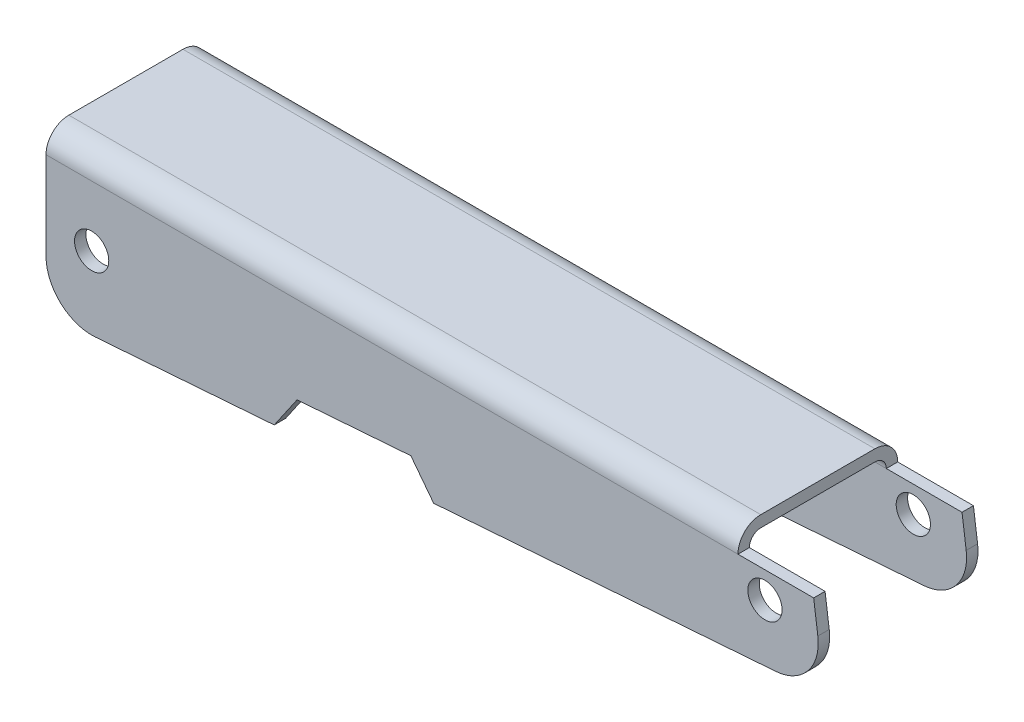
from build123d import *

# Parameters (mm, degrees)
SKETCH1_R               = 1.5
BOSS_EXTRUDE1_DEPTH     = 7
FILLET1_R               = 2
FILLET2_R               = 4
SHELL1_T                = -1
CUT_EXTRUDE1_DEPTH      = 65.079559318
CUT_EXTRUDE1_DEPTH_BACK = 65.079559318
SKETCH3_W               = 7
SKETCH3_H               = 14
CUT_EXTRUDE2_DEPTH      = 2


with BuildPart() as part:
    # Sketch1 → Boss-Extrude1 (new, symmetric)
    with BuildSketch(Plane.XY):
        Polygon((4, 4.3), (-63, 4.3), (-63, -9.7), (5.2, -4.619641248), align=None)
        Circle(SKETCH1_R, mode=Mode.SUBTRACT)
        with Locations((-59, -3)):
            Circle(SKETCH1_R, mode=Mode.SUBTRACT)
    extrude(amount=BOSS_EXTRUDE1_DEPTH, both=True)

    # Fillet1
    fillet1_edges = [part.edges().sort_by_distance(p)[0] for p in [
        (-29.5, 4.3, 7),
        (-29.5, 4.3, -7),
    ]]
    fillet(fillet1_edges, radius=FILLET1_R)

    # Fillet2
    fillet2_edges = [part.edges().sort_by_distance(p)[0] for p in [
        (-63, -9.7, 0),
        (5.2, -4.619641248, 0),
    ]]
    fillet(fillet2_edges, radius=FILLET2_R)

    # Shell1
    shell1_openings = [part.faces().sort_by_distance(p)[0] for p in [
        (-60.5, -3, 0),
        (-1.5, 0, 0),
        (-61.721343434, -8.3225509, 0),
        (3.776615154, -3.465411477, 0),
        (-63, -0.601849653, 0),
        (4.323873752, 1.892635268, 0),
        (-28.867987445, -7.157435943, 0),
    ]]
    offset(amount=SHELL1_T, openings=shell1_openings, kind=Kind.INTERSECTION)

    # Sketch2 → Cut-Extrude1 (cut, two sides: drawn at the far end of the back side and taken through both)
    with BuildSketch(Plane.XY.offset(-CUT_EXTRUDE1_DEPTH_BACK)):
        Polygon((-43, -8.210158724), (-41, -5.303555184), (-31.027630399, -4.560692791), (-29.027630399, -7.169328076), align=None)
    extrude(amount=CUT_EXTRUDE1_DEPTH + CUT_EXTRUDE1_DEPTH_BACK, mode=Mode.SUBTRACT)

    # Sketch3 → Cut-Extrude2 (cut)
    with BuildSketch(Plane(origin=(0, 4.3, 0), x_dir=(1, 0, 0), z_dir=(0, 1, 0))):
        with Locations((1.134020196, 0)):
            Rectangle(SKETCH3_W, SKETCH3_H)
    extrude(amount=-CUT_EXTRUDE2_DEPTH, mode=Mode.SUBTRACT)


solid = part.part
